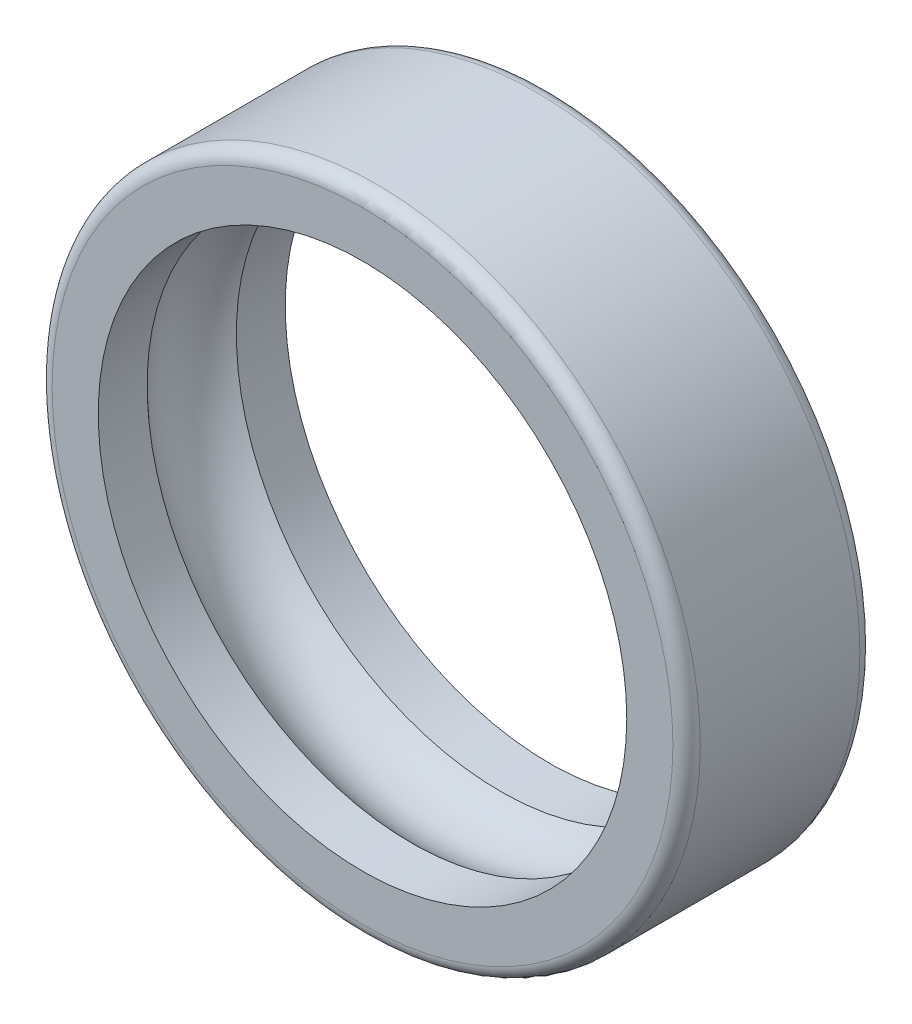
from build123d import *

# Parameters (mm, degrees)
CONG_1_R       = 1.1
ECHELLE1_SCALE = 0.69


with BuildPart() as part:
    # Esquisse1 → Révolution1 (revolve)
    with BuildSketch(Plane(origin=(0, 0, 0), x_dir=(0, 0, -1), z_dir=(1, 0, 0)), mode=Mode.PRIVATE) as r_volution1_sk:
        with BuildLine():
            Line((-7.5, 26), (-7.5, 21.2))
            Line((-7.5, 21.2), (-3.577708764, 21.2))
            ThreePointArc((-3.577708764, 21.2), (0, 22.8), (3.577708764, 21.2))
            Line((3.577708764, 21.2), (7.5, 21.2))
            Line((7.5, 21.2), (7.5, 26))
            Line((7.5, 26), (-7.5, 26))
        make_face()
    revolve(r_volution1_sk.sketch.rotate(Axis((0, 0, 0), (0, 0, -1)), 90), axis=Axis((0, 0, 0), (0, 0, -1)))

    # Congé1
    cong_1_edges = [part.edges().sort_by_distance(p)[0] for p in [
        (-26, 0, 7.5),
        (-26, 0, -7.5),
    ]]
    fillet(cong_1_edges, radius=CONG_1_R)


with BuildPart() as part_1:
    # Echelle1: scaled about (0, 0, 0)
    add(part.part.scale(ECHELLE1_SCALE))


solid = part_1.part
